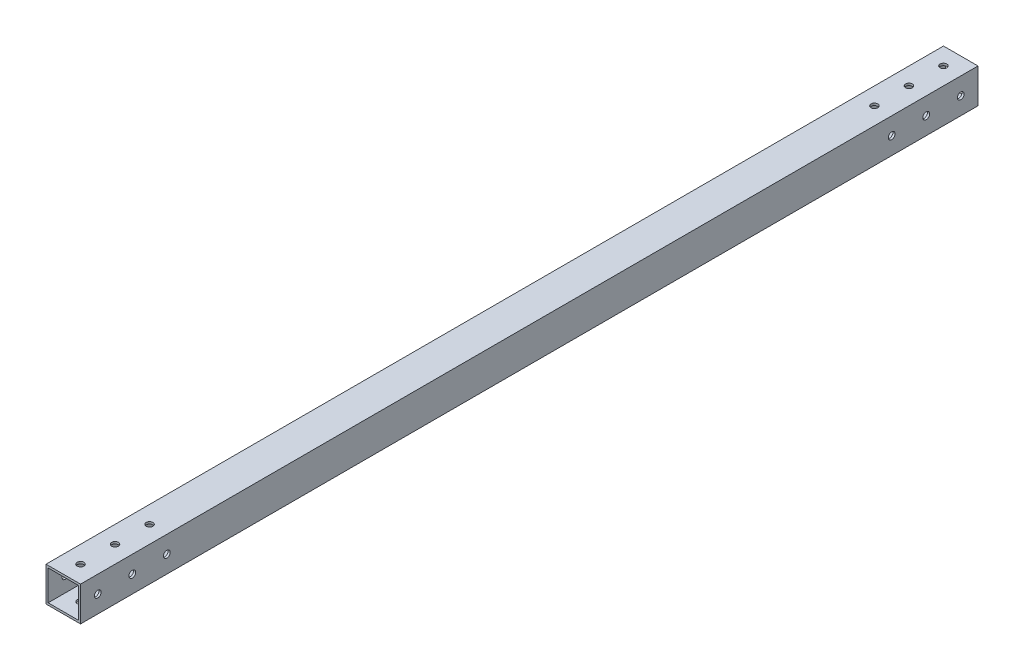
from build123d import *

# Parameters (mm, degrees)
SKETCH5_W           = 25.4
SKETCH5_H           = 25.4
BOSS_EXTRUDE2_DEPTH = 330.2
SHELL3_T            = -1.5875
SKETCH6_R           = 2.4892
CUT_EXTRUDE2_DEPTH  = 333.148099498
SKETCH7_R           = 2.4892
CUT_EXTRUDE3_DEPTH  = 333.148099498


with BuildPart() as part:
    # Sketch5 → Boss-Extrude2 (new, symmetric)
    with BuildSketch(Plane.XY):
        with Locations((12.7, 12.7)):
            Rectangle(SKETCH5_W, SKETCH5_H)
    extrude(amount=BOSS_EXTRUDE2_DEPTH, both=True)

    # Shell3
    shell3_openings = [part.faces().sort_by_distance(p)[0] for p in [
        (12.7, 12.7, 330.2),
        (12.7, 12.7, -330.2),
    ]]
    offset(amount=SHELL3_T, openings=shell3_openings, kind=Kind.INTERSECTION)

    # Sketch6 → Cut-Extrude2 (cut, through all)
    with BuildSketch(Plane(origin=(0, 25.4, 0), x_dir=(1, 0, 0), z_dir=(0, 1, 0))):
        with Locations(Location((12.7, 317.5, 0), (0, 0, 270))):
            Circle(SKETCH6_R)
        with Locations(Location((12.7, 292.1, 0), (0, 0, 270))):
            Circle(SKETCH6_R)
        with Locations(Location((12.7, 266.7, 0), (0, 0, 270))):
            Circle(SKETCH6_R)
    cut_extrude2 = extrude(amount=-CUT_EXTRUDE2_DEPTH, mode=Mode.SUBTRACT)

    # Sketch7 → Cut-Extrude3 (cut, through all)
    with BuildSketch(Plane(origin=(25.4, 0, 0), x_dir=(0, 0, -1), z_dir=(1, 0, 0))):
        with Locations(Location((292.1, 12.7, 0), (0, 0, 90))):
            Circle(SKETCH7_R)
        with Locations(Location((317.5, 12.7, 0), (0, 0, 90))):
            Circle(SKETCH7_R)
        with Locations(Location((266.7, 12.7, 0), (0, 0, 90))):
            Circle(SKETCH7_R)
    cut_extrude3 = extrude(amount=-CUT_EXTRUDE3_DEPTH, mode=Mode.SUBTRACT)

    # Mirror2: Cut-Extrude2, Cut-Extrude3 across plane
    add(cut_extrude2.mirror(Plane.XY), mode=Mode.SUBTRACT)
    add(cut_extrude3.mirror(Plane.XY), mode=Mode.SUBTRACT)


solid = part.part
